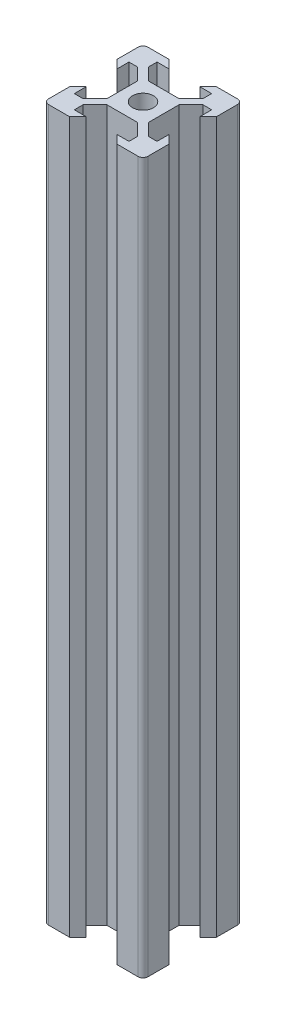
from build123d import *

# Parameters (mm, degrees)
MASTERLAYOUTSKETCH_R = 2.1
MAIN_EXTRUSION_DEPTH = 143
EDGE_FILLETS_R       = 1


with BuildPart() as part:
    # MasterLayoutSketch → Main Extrusion (new body)
    with BuildSketch(Plane(origin=(0, 0, 0), x_dir=(1, 0, 0), z_dir=(0, 1, 0))):
        Polygon((-8.325, 3.1), (-8.325, 5.5), (-6.560660172, 5.5), (-4.160660172, 3.1), (-4.160660172, -3.1), (-6.560660172, -5.5), (-8.325, -5.5), (-8.325, -3.1), (-10, -4.775), (-10, -10), (-4.775, -10), (-3.1, -8.325), (-5.5, -8.325), (-5.5, -6.560660172), (-3.1, -4.160660172), (3.1, -4.160660172), (5.5, -6.560660172), (5.5, -8.325), (3.1, -8.325), (4.775, -10), (10, -10), (10, -4.775), (8.325, -3.1), (8.325, -5.5), (6.560660172, -5.5), (4.160660172, -3.1), (4.160660172, 3.1), (6.560660172, 5.5), (8.325, 5.5), (8.325, 3.1), (10, 4.775), (10, 10), (4.775, 10), (3.1, 8.325), (5.5, 8.325), (5.5, 6.560660172), (3.1, 4.160660172), (-3.1, 4.160660172), (-5.5, 6.560660172), (-5.5, 8.325), (-3.1, 8.325), (-4.775, 10), (-10, 10), (-10, 4.775), align=None)
        with Locations(Location((0, 0, 0), (0, 0, 270))):
            Circle(MASTERLAYOUTSKETCH_R, mode=Mode.SUBTRACT)
    extrude(amount=MAIN_EXTRUSION_DEPTH)

    # Edge Fillets
    edge_fillets_edges = [part.edges().sort_by_distance(p)[0] for p in [
        (10, 71.5, -10),
        (10, 71.5, 10),
        (-10, 71.5, 10),
        (-10, 71.5, -10),
    ]]
    fillet(edge_fillets_edges, radius=EDGE_FILLETS_R)


solid = part.part
